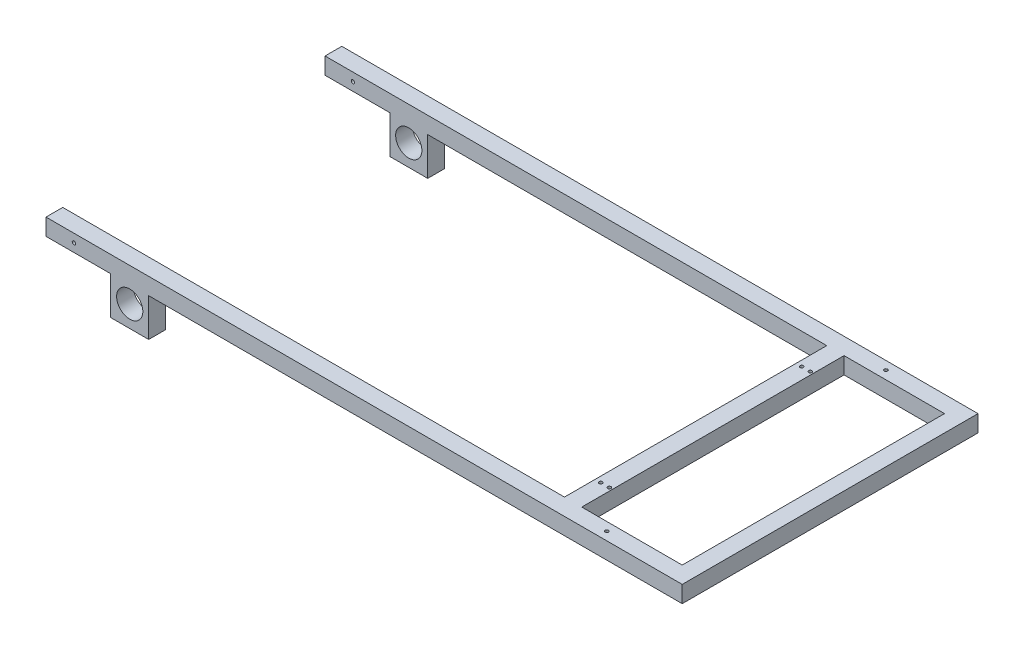
from build123d import *

# Parameters (mm, degrees)
SKETCH_1_W          = 1980
SKETCH_1_H          = 530
SKETCH_1_W_2        = 1920
SKETCH_1_H_2        = 470
EXTRUDE_1_DEPTH     = 30
SKETCH_2_W          = 68
SKETCH_2_H          = 30
EXTRUDE_2_DEPTH     = 68
SKETCH_3_R          = 23.5
CUT_EXTRUDE_1_DEPTH = 1125.999555555
SKETCH_4_W          = 31
SKETCH_4_H          = 470
EXTRUDE_3_DEPTH     = 30
SKETCH_5_R          = 3
CUT_EXTRUDE_2_DEPTH = 1030.528532873
SKETCH_6_R          = 3
CUT_EXTRUDE_3_DEPTH = 1030.528532873
SKETCH_7_W          = 883.399544852
SKETCH_7_H          = 30
CUT_EXTRUDE_4_DEPTH = 1125.999555555
SKETCH_8_R          = 3
CUT_EXTRUDE_5_DEPTH = 1125.999555555


with BuildPart() as part:
    # 草图1 → 凸台-拉伸1 (new body)
    with BuildSketch(Plane(origin=(0, 0, 0), x_dir=(1, 0, 0), z_dir=(0, 1, 0))):
        Rectangle(SKETCH_1_W, SKETCH_1_H)
        Rectangle(SKETCH_1_W_2, SKETCH_1_H_2, mode=Mode.SUBTRACT)
    extrude(amount=EXTRUDE_1_DEPTH)

    # 草图2 → 凸台-拉伸2 (add)
    with BuildSketch(Plane.XZ):
        with Locations((0, 250)):
            Rectangle(SKETCH_2_W, SKETCH_2_H)
        with Locations((0, -250)):
            Rectangle(SKETCH_2_W, SKETCH_2_H)
    extrude(amount=EXTRUDE_2_DEPTH)

    # 草图3 → 切除-拉伸1 (cut, through all)
    with BuildSketch(Plane.XY.offset(265)):
        with Locations((0, -30)):
            Circle(SKETCH_3_R)
    extrude(amount=-CUT_EXTRUDE_1_DEPTH, mode=Mode.SUBTRACT)

    # 草图4 → 凸台-拉伸3 (add)
    with BuildSketch(Plane(origin=(0, 30, 0), x_dir=(1, 0, 0), z_dir=(0, 1, 0))):
        with Locations((764.5, 0)):
            Rectangle(SKETCH_4_W, SKETCH_4_H)
    extrude(amount=-EXTRUDE_3_DEPTH)

    # 草图5 → 切除-拉伸2 (cut, through all)
    with BuildSketch(Plane(origin=(0, 30, 0), x_dir=(1, 0, 0), z_dir=(0, 1, 0))):
        with Locations(Location((759, 180, 0), (0, 0, 270))):
            Circle(SKETCH_5_R)
        with Locations(Location((774.5, 180, 0), (0, 0, 270))):
            Circle(SKETCH_5_R)
        with Locations(Location((759, -180, 0), (0, 0, 270))):
            Circle(SKETCH_5_R)
        with Locations(Location((774.5, -180, 0), (0, 0, 270))):
            Circle(SKETCH_5_R)
    extrude(amount=-CUT_EXTRUDE_2_DEPTH, mode=Mode.SUBTRACT)

    # 草图6 → 切除-拉伸3 (cut, symmetric)
    with BuildSketch(Plane(origin=(0, 30, 0), x_dir=(1, 0, 0), z_dir=(0, 1, 0))):
        with Locations(Location((840, -250, 0), (0, 0, 270))):
            Circle(SKETCH_6_R)
    cut_extrude_3 = extrude(amount=CUT_EXTRUDE_3_DEPTH, both=True, mode=Mode.SUBTRACT)

    # 镜向1: 切除-拉伸3 across plane
    add(cut_extrude_3.mirror(Plane.XY), mode=Mode.SUBTRACT)

    # 草图7 → 切除-拉伸4 (cut, through all)
    with BuildSketch(Plane.XY.offset(265)):
        with Locations((-591.699772426, 15)):
            Rectangle(SKETCH_7_W, SKETCH_7_H)
    extrude(amount=-CUT_EXTRUDE_4_DEPTH, mode=Mode.SUBTRACT)

    # 草图8 → 切除-拉伸5 (cut, through all)
    with BuildSketch(Plane.XY.offset(265)):
        with Locations((-100, 15)):
            Circle(SKETCH_8_R)
    extrude(amount=-CUT_EXTRUDE_5_DEPTH, mode=Mode.SUBTRACT)


solid = part.part
